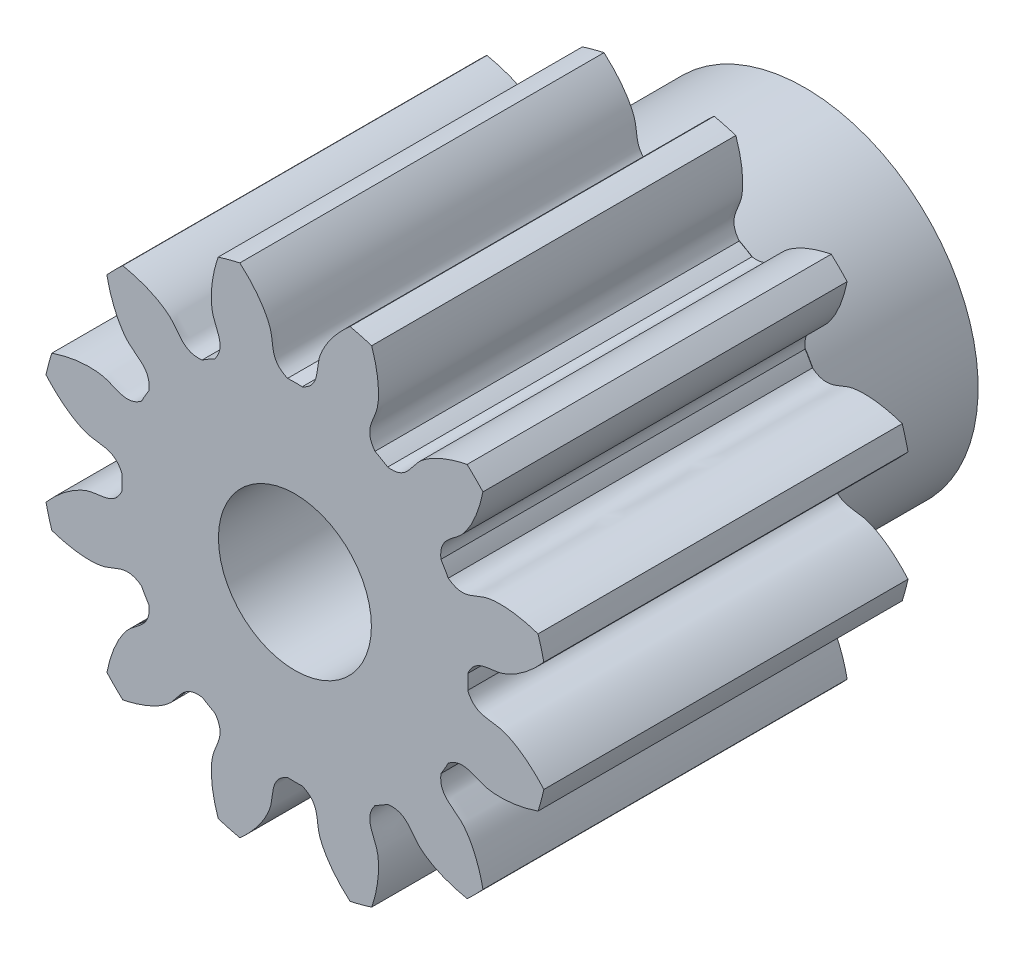
from build123d import *

# Parameters (mm, degrees)
SKETCH_1_R               = 3.5
EXTRUDE_1_DEPTH          = 5
CUT_EXTRUDE_1_DEPTH      = 8.03562364
PATTERN_CIRCULAR_1_COUNT = 12
SKETCH_4_R               = 2.38
EXTRUDE_2_DEPTH          = 2
CUT_EXTRUDE_2_REACH      = 10.506
SKETCH_5_R               = 1.05


with BuildPart() as part:
    # 草图1 → 凸台-拉伸1 (new body)
    with BuildSketch(Plane.XY):
        Circle(SKETCH_1_R)
    extrude(amount=EXTRUDE_1_DEPTH)

    # 草图2 → 切除-拉伸1 (cut, through all)
    with BuildSketch(Plane.XY):
        with BuildLine():
            ThreePointArc((0.100420056, 2.372876063), (0, 2.375), (-0.100420056, 2.372876063))
            add(Edge.make_bspline(
                [(-0.100420056, 2.372876063), (-0.340394435, 2.474653731), (-0.287186739, 2.672409341), (-0.338076094, 2.844740289), (-0.341311927, 2.854952869), (-0.345113625, 2.866166713), (-0.349521434, 2.878363044), (-0.354576313, 2.891521619), (-0.360318258, 2.905621034), (-0.36678678, 2.920638648), (-0.374020716, 2.936550626), (-0.382058239, 2.95333195), (-0.390936819, 2.970956436), (-0.400693193, 2.989396753), (-0.411363332, 3.008624444), (-0.422982412, 3.02860994), (-0.435584786, 3.049322589), (-0.449203949, 3.07073067), (-0.463872517, 3.092801417), (-0.479622192, 3.115501045), (-0.496483738, 3.138794769), (-0.514486952, 3.162646832), (-0.533660639, 3.187020528), (-0.554032585, 3.211878226), (-0.575629533, 3.237181399), (-0.598477155, 3.262890651), (-0.622600033, 3.288965742), (-0.648021632, 3.315365616), (-0.674764279, 3.342048434), (-0.702849139, 3.368971597), (-0.732296196, 3.396091781), (-0.763124233, 3.423364967), (-0.795350811, 3.450746465), (-0.828992247, 3.478190957), (-0.864063604, 3.505652518), (-0.900578664, 3.533084654), (-0.938549918, 3.560440334), (-0.977988547, 3.587672024), (-1.01890441, 3.614731718), (-1.061306025, 3.641570973), (-1.10520056, 3.668140947), (-1.150593819, 3.694392428), (-1.197490231, 3.720275872), (-1.245892835, 3.74574144), (-1.295803277, 3.770739031), (-1.347221796, 3.79521832), (-1.400147219, 3.819128792), (-1.454576948, 3.842419781), (-1.510506963, 3.865040505), (-1.567931802, 3.886940103), (-1.647189853, 3.915363979), (-1.7077968, 3.935050704), (-1.748802701, 3.947485455)],
                knots=[0, 0, 0, 0, 0.218015236, 0.222043642, 0.226545979, 0.231522246, 0.236972443, 0.24289657, 0.249294627, 0.256166614, 0.263512532, 0.271332379, 0.279626157, 0.288393865, 0.297635503, 0.307351072, 0.31754057, 0.328203999, 0.339341357, 0.350952646, 0.363037866, 0.375597015, 0.388630094, 0.402137104, 0.416118043, 0.430572913, 0.445501713, 0.460904444, 0.476781104, 0.493131694, 0.509956215, 0.527254666, 0.545027047, 0.563273358, 0.581993599, 0.601187771, 0.620855872, 0.640997904, 0.661613866, 0.682703758, 0.704267581, 0.726305333, 0.748817015, 0.771802628, 0.795262171, 0.819195644, 0.843603047, 0.868484381, 0.893839644, 0.919668838, 0.945971962, 1, 1, 1, 1], degree=3))
            ThreePointArc((-1.748802701, 3.947485455), (0, 4.317516914), (1.748802701, 3.947485455))
            add(Edge.make_bspline(
                [(0.100420056, 2.372876063), (0.340394435, 2.474653731), (0.287186739, 2.672409341), (0.338076094, 2.844740289), (0.341311927, 2.854952869), (0.345113625, 2.866166713), (0.349521434, 2.878363044), (0.354576313, 2.891521619), (0.360318258, 2.905621034), (0.36678678, 2.920638648), (0.374020716, 2.936550626), (0.382058239, 2.95333195), (0.390936819, 2.970956436), (0.400693193, 2.989396753), (0.411363332, 3.008624444), (0.422982412, 3.02860994), (0.435584786, 3.049322589), (0.449203949, 3.07073067), (0.463872517, 3.092801417), (0.479622192, 3.115501045), (0.496483738, 3.138794769), (0.514486952, 3.162646832), (0.533660639, 3.187020528), (0.554032585, 3.211878226), (0.575629533, 3.237181399), (0.598477155, 3.262890651), (0.622600033, 3.288965742), (0.648021632, 3.315365616), (0.674764279, 3.342048434), (0.702849139, 3.368971597), (0.732296196, 3.396091781), (0.763124233, 3.423364967), (0.795350811, 3.450746465), (0.828992247, 3.478190957), (0.864063604, 3.505652518), (0.900578664, 3.533084654), (0.938549918, 3.560440334), (0.977988547, 3.587672024), (1.01890441, 3.614731718), (1.061306025, 3.641570973), (1.10520056, 3.668140947), (1.150593819, 3.694392428), (1.197490231, 3.720275872), (1.245892835, 3.74574144), (1.295803277, 3.770739031), (1.347221796, 3.79521832), (1.400147219, 3.819128792), (1.454576948, 3.842419781), (1.510506963, 3.865040505), (1.567931802, 3.886940103), (1.647189853, 3.915363979), (1.7077968, 3.935050704), (1.748802701, 3.947485455)],
                knots=[0, 0, 0, 0, 0.218015236, 0.222043642, 0.226545979, 0.231522246, 0.236972443, 0.24289657, 0.249294627, 0.256166614, 0.263512532, 0.271332379, 0.279626157, 0.288393865, 0.297635503, 0.307351072, 0.31754057, 0.328203999, 0.339341357, 0.350952646, 0.363037866, 0.375597015, 0.388630094, 0.402137104, 0.416118043, 0.430572913, 0.445501713, 0.460904444, 0.476781104, 0.493131694, 0.509956215, 0.527254666, 0.545027047, 0.563273358, 0.581993599, 0.601187771, 0.620855872, 0.640997904, 0.661613866, 0.682703758, 0.704267581, 0.726305333, 0.748817015, 0.771802628, 0.795262171, 0.819195644, 0.843603047, 0.868484381, 0.893839644, 0.919668838, 0.945971962, 1, 1, 1, 1], degree=3))
        make_face()
    cut_extrude_1 = extrude(amount=CUT_EXTRUDE_1_DEPTH, mode=Mode.SUBTRACT)

    # 阵列(圆周)1: 切除-拉伸1 ×12 about axis
    pattern_circular_1_axis = Axis((0, 0, 5), (0, 0, -1))
    for i in range(1, PATTERN_CIRCULAR_1_COUNT):
        add(cut_extrude_1.rotate(pattern_circular_1_axis, i * 360 / PATTERN_CIRCULAR_1_COUNT), mode=Mode.SUBTRACT)

    # 草图4 → 凸台-拉伸2 (add)
    with BuildSketch(Plane(origin=(0, 0, 0), x_dir=(-1, 0, 0), z_dir=(0, 0, -1))):
        Circle(SKETCH_4_R)
    extrude(amount=EXTRUDE_2_DEPTH)

    # 草图5 → 切除-拉伸2 (cut, up to next)
    with BuildSketch(Plane(origin=(0, 0, -2), x_dir=(-1, 0, 0), z_dir=(0, 0, -1)), mode=Mode.PRIVATE) as cut_extrude_2_sk1:
        Circle(SKETCH_5_R)
    cut_extrude_2_tool1 = extrude(cut_extrude_2_sk1.sketch, amount=-CUT_EXTRUDE_2_REACH, mode=Mode.PRIVATE) & part.part
    add(cut_extrude_2_tool1.solids().sort_by_distance((0, 0, -2))[0], mode=Mode.SUBTRACT)


solid = part.part
